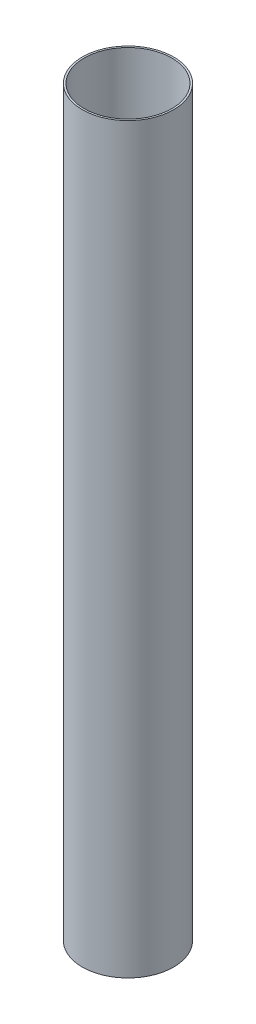
from build123d import *

# Parameters (mm, degrees)
SKETCH1_W = 2.0574
SKETCH1_H = 838.2


with BuildPart() as part:
    # Sketch1 → Revolve1 (revolve)
    with BuildSketch(Plane.XY, mode=Mode.PRIVATE) as revolve1_sk:
        with Locations((50.5587, 419.1)):
            Rectangle(SKETCH1_W, SKETCH1_H)
    revolve(revolve1_sk.sketch.rotate(Axis((0, 123.620053705, 0), (0, -1, 0)), 90), axis=Axis((0, 123.620053705, 0), (0, -1, 0)))


solid = part.part
